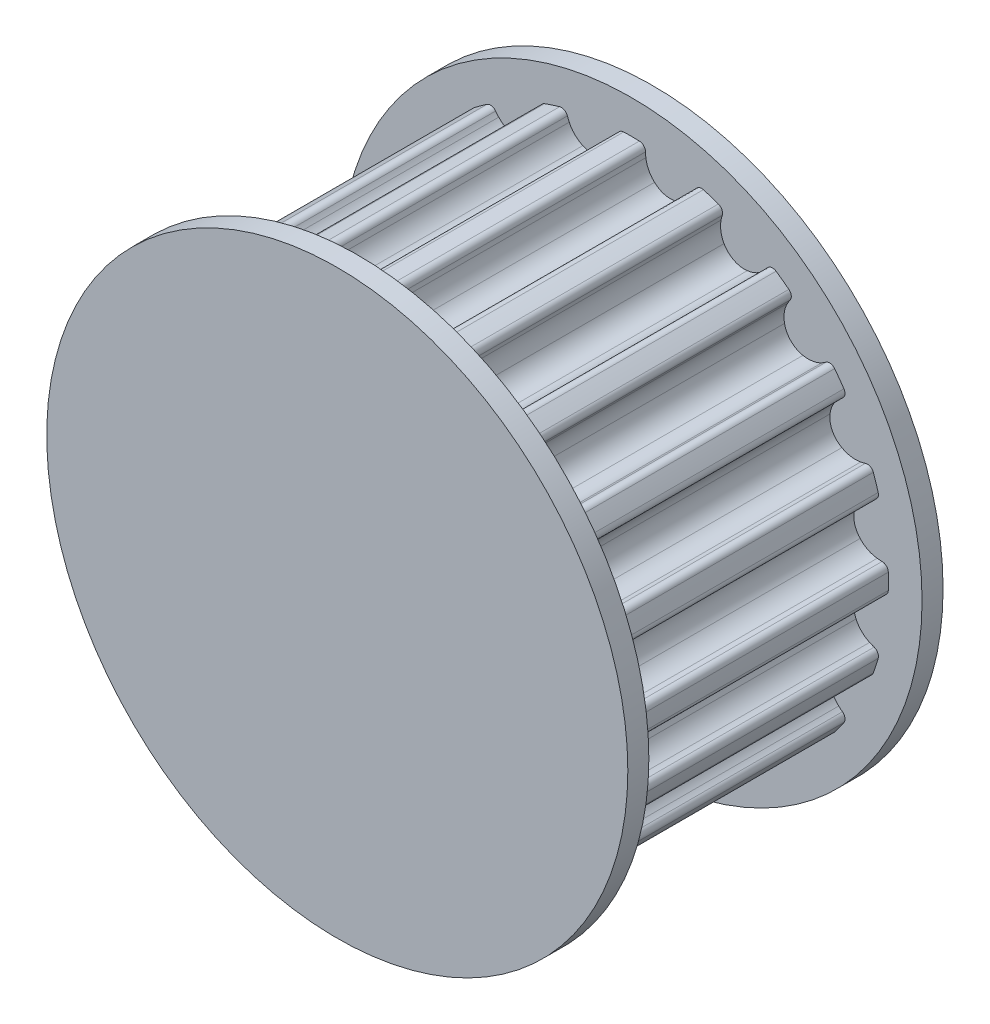
from build123d import *

# Parameters (mm, degrees)
BOSS_EXTRUDE1_DEPTH          = 6.5
CIRPATTERN1_COUNT            = 20
SKETCH2_R                    = 5.362197724
BOSS_EXTRUDE2_DEPTH          = 6.5
SCHIZZO1_R                   = 6.912197724
ESTRUSIONE_ESTRUSIONE1_DEPTH = 0.5


with BuildPart() as part:
    # Sketch1 → Boss-Extrude1 (new body)
    with BuildSketch(Plane.XY):
        with BuildLine():
            ThreePointArc((0.838832532, 5.296180172), (0.682371389, 5.345509816), (0.547166891, 5.438425083))
            ThreePointArc((0.547166891, 5.438425083), (0.408048432, 5.623143766), (0.340639395, 5.844347201))
            ThreePointArc((0.340639395, 5.844347201), (0.335313092, 5.902123138), (0.333346558, 5.960110732))
            ThreePointArc((0.333346558, 5.960110732), (0.290777478, 6.064063067), (0.187961119, 6.109306968))
            ThreePointArc((0.187961119, 6.109306968), (0, 6.112197724), (-0.187961119, 6.109306968))
            ThreePointArc((-0.187961119, 6.109306968), (-0.290777478, 6.064063067), (-0.333346558, 5.960110732))
            ThreePointArc((-0.333346558, 5.960110732), (-0.335313092, 5.902123138), (-0.340639395, 5.844347201))
            ThreePointArc((-0.340639395, 5.844347201), (-0.408048432, 5.623143766), (-0.547166891, 5.438425083))
            ThreePointArc((-0.547166891, 5.438425083), (-0.682371389, 5.345509816), (-0.838832532, 5.296180172))
            ThreePointArc((-0.838832532, 5.296180172), (0, 5.362197724), (0.838832532, 5.296180172))
        make_face()
    extrude(amount=BOSS_EXTRUDE1_DEPTH)


with BuildPart() as cirpattern1_1:
    # CirPattern1: pattern copy
    add(part.part.rotate(Axis((0, 0, 0), (0, 0, 1)), 1 * 360 / CIRPATTERN1_COUNT))


with BuildPart() as cirpattern1_2:
    # CirPattern1: pattern copy
    add(part.part.rotate(Axis((0, 0, 0), (0, 0, 1)), 2 * 360 / CIRPATTERN1_COUNT))


with BuildPart() as cirpattern1_3:
    # CirPattern1: pattern copy
    add(part.part.rotate(Axis((0, 0, 0), (0, 0, 1)), 3 * 360 / CIRPATTERN1_COUNT))


with BuildPart() as cirpattern1_4:
    # CirPattern1: pattern copy
    add(part.part.rotate(Axis((0, 0, 0), (0, 0, 1)), 4 * 360 / CIRPATTERN1_COUNT))


with BuildPart() as cirpattern1_5:
    # CirPattern1: pattern copy
    add(part.part.rotate(Axis((0, 0, 0), (0, 0, 1)), 5 * 360 / CIRPATTERN1_COUNT))


with BuildPart() as cirpattern1_6:
    # CirPattern1: pattern copy
    add(part.part.rotate(Axis((0, 0, 0), (0, 0, 1)), 6 * 360 / CIRPATTERN1_COUNT))


with BuildPart() as cirpattern1_7:
    # CirPattern1: pattern copy
    add(part.part.rotate(Axis((0, 0, 0), (0, 0, 1)), 7 * 360 / CIRPATTERN1_COUNT))


with BuildPart() as cirpattern1_8:
    # CirPattern1: pattern copy
    add(part.part.rotate(Axis((0, 0, 0), (0, 0, 1)), 8 * 360 / CIRPATTERN1_COUNT))


with BuildPart() as cirpattern1_9:
    # CirPattern1: pattern copy
    add(part.part.rotate(Axis((0, 0, 0), (0, 0, 1)), 9 * 360 / CIRPATTERN1_COUNT))


with BuildPart() as cirpattern1_10:
    # CirPattern1: pattern copy
    add(part.part.rotate(Axis((0, 0, 0), (0, 0, 1)), 10 * 360 / CIRPATTERN1_COUNT))


with BuildPart() as cirpattern1_11:
    # CirPattern1: pattern copy
    add(part.part.rotate(Axis((0, 0, 0), (0, 0, 1)), 11 * 360 / CIRPATTERN1_COUNT))


with BuildPart() as cirpattern1_12:
    # CirPattern1: pattern copy
    add(part.part.rotate(Axis((0, 0, 0), (0, 0, 1)), 12 * 360 / CIRPATTERN1_COUNT))


with BuildPart() as cirpattern1_13:
    # CirPattern1: pattern copy
    add(part.part.rotate(Axis((0, 0, 0), (0, 0, 1)), 13 * 360 / CIRPATTERN1_COUNT))


with BuildPart() as cirpattern1_14:
    # CirPattern1: pattern copy
    add(part.part.rotate(Axis((0, 0, 0), (0, 0, 1)), 14 * 360 / CIRPATTERN1_COUNT))


with BuildPart() as cirpattern1_15:
    # CirPattern1: pattern copy
    add(part.part.rotate(Axis((0, 0, 0), (0, 0, 1)), 15 * 360 / CIRPATTERN1_COUNT))


with BuildPart() as cirpattern1_16:
    # CirPattern1: pattern copy
    add(part.part.rotate(Axis((0, 0, 0), (0, 0, 1)), 16 * 360 / CIRPATTERN1_COUNT))


with BuildPart() as cirpattern1_17:
    # CirPattern1: pattern copy
    add(part.part.rotate(Axis((0, 0, 0), (0, 0, 1)), 17 * 360 / CIRPATTERN1_COUNT))


with BuildPart() as cirpattern1_18:
    # CirPattern1: pattern copy
    add(part.part.rotate(Axis((0, 0, 0), (0, 0, 1)), 18 * 360 / CIRPATTERN1_COUNT))


with BuildPart() as cirpattern1_19:
    # CirPattern1: pattern copy
    add(part.part.rotate(Axis((0, 0, 0), (0, 0, 1)), 19 * 360 / CIRPATTERN1_COUNT))


with BuildPart() as part_1:
    add(part.part)

    add(cirpattern1_1.part)  # Boss-Extrude2 merges CirPattern1_1

    add(cirpattern1_2.part)  # Boss-Extrude2 merges CirPattern1_2

    add(cirpattern1_3.part)  # Boss-Extrude2 merges CirPattern1_3

    add(cirpattern1_4.part)  # Boss-Extrude2 merges CirPattern1_4

    add(cirpattern1_5.part)  # Boss-Extrude2 merges CirPattern1_5

    add(cirpattern1_6.part)  # Boss-Extrude2 merges CirPattern1_6

    add(cirpattern1_7.part)  # Boss-Extrude2 merges CirPattern1_7

    add(cirpattern1_8.part)  # Boss-Extrude2 merges CirPattern1_8

    add(cirpattern1_9.part)  # Boss-Extrude2 merges CirPattern1_9

    add(cirpattern1_10.part)  # Boss-Extrude2 merges CirPattern1_10

    add(cirpattern1_11.part)  # Boss-Extrude2 merges CirPattern1_11

    add(cirpattern1_12.part)  # Boss-Extrude2 merges CirPattern1_12

    add(cirpattern1_13.part)  # Boss-Extrude2 merges CirPattern1_13

    add(cirpattern1_14.part)  # Boss-Extrude2 merges CirPattern1_14

    add(cirpattern1_15.part)  # Boss-Extrude2 merges CirPattern1_15

    add(cirpattern1_16.part)  # Boss-Extrude2 merges CirPattern1_16

    add(cirpattern1_17.part)  # Boss-Extrude2 merges CirPattern1_17

    add(cirpattern1_18.part)  # Boss-Extrude2 merges CirPattern1_18

    add(cirpattern1_19.part)  # Boss-Extrude2 merges CirPattern1_19
    # Sketch2 → Boss-Extrude2 (add)
    with BuildSketch(Plane(origin=(0, 0, 0), x_dir=(-1, 0, 0), z_dir=(0, 0, -1))):
        Circle(SKETCH2_R)
    extrude(amount=-BOSS_EXTRUDE2_DEPTH)

    # Schizzo1 → Estrusione-Estrusione1 (add)
    with BuildSketch(Plane.XY.offset(6.5)):
        Circle(SCHIZZO1_R)
    estrusione_estrusione1 = extrude(amount=ESTRUSIONE_ESTRUSIONE1_DEPTH)

    # Specchia1: Estrusione-Estrusione1 across plane
    add(estrusione_estrusione1.mirror(Plane(origin=(0, 0, 3.25), x_dir=(1, 0, 0), z_dir=(0, 0, -1))))


solid = part_1.part
